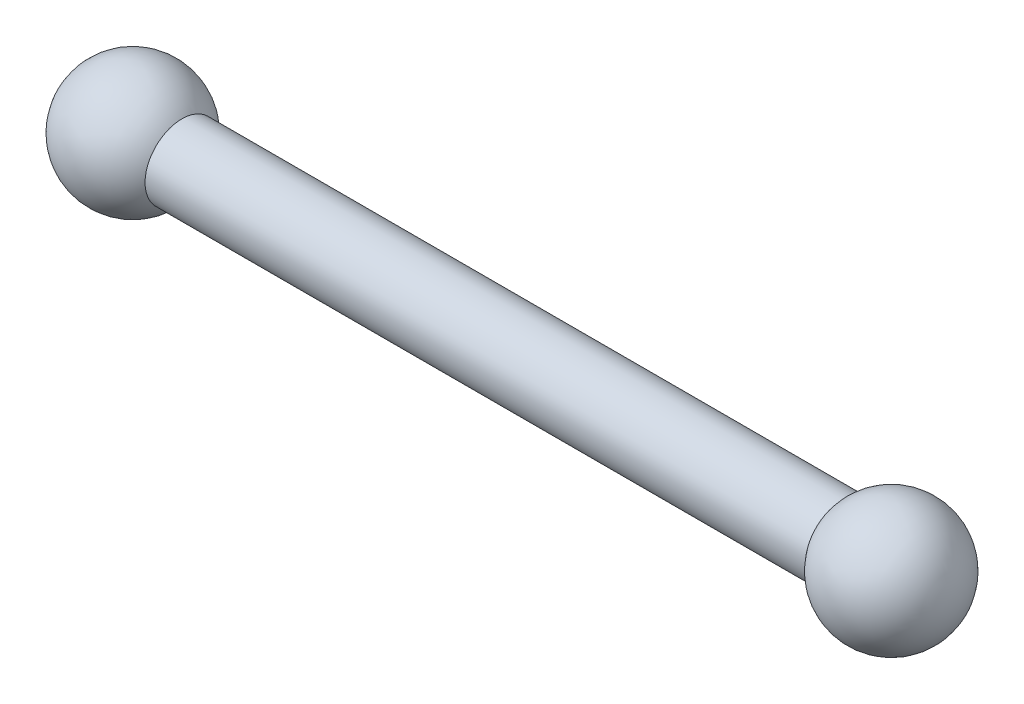
from build123d import *

# Parameters (mm, degrees)
SKETCH5_R   = 1.5
SHAFT_DEPTH = 30.9


with BuildPart() as part:
    # Sketch4 → Semi-circle Revolve (revolve)
    with BuildSketch(Plane(origin=(0, 0, 0), x_dir=(0, 0, -1), z_dir=(1, 0, 0))):
        with BuildLine():
            Line((0, 0), (2.5, 0))
            Line((2.5, 0), (2.5, -2.5))
            ThreePointArc((2.5, -2.5), (0.732233047, -1.767766953), (0, 0))
        make_face()
    semi_circle_revolve = revolve(axis=Axis((0, 0, -2.5), (0, -1, 0)))

    # Full-circle Mirror: Semi-circle Revolve across plane
    add(semi_circle_revolve.mirror(Plane(origin=(0, 0, 0), x_dir=(0, 0, 1), z_dir=(0, -1, 0))))

    # Sketch5 → Shaft (add)
    with BuildSketch(Plane(origin=(0, 0, 0), x_dir=(0, 0, -1), z_dir=(1, 0, 0))):
        with Locations(Location((2.5, 0, 0), (0, 0, 180))):
            Circle(SKETCH5_R)
    extrude(amount=SHAFT_DEPTH)

    # Sketch6 → Opposite Semi-circle Revolve (revolve)
    with BuildSketch(Plane(origin=(30.9, 0, 0), x_dir=(0, 0, -1), z_dir=(1, 0, 0))):
        with BuildLine():
            Line((0, 0), (2.5, 0))
            Line((2.5, 0), (2.5, -2.5))
            ThreePointArc((2.5, -2.5), (0.732233047, -1.767766953), (0, 0))
        make_face()
    opposite_semi_circle_revolve = revolve(axis=Axis((30.9, 0, -2.5), (0, -1, 0)))

    # Opposite Full-circle Mirror: Opposite Semi-circle Revolve across plane
    add(opposite_semi_circle_revolve.mirror(Plane(origin=(30.9, 0, 0), x_dir=(0, 0, 1), z_dir=(0, 1, 0))))


solid = part.part
